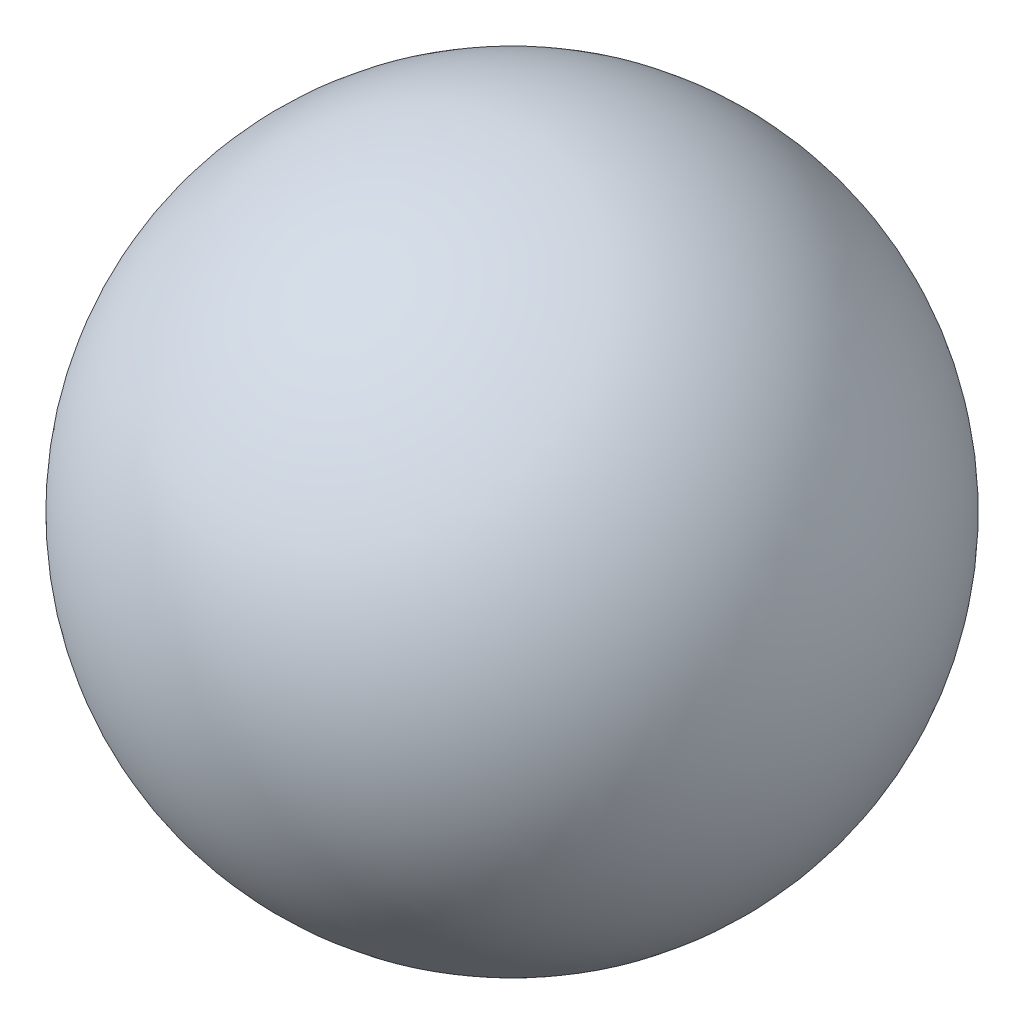
from build123d import *


with BuildPart() as part:
    # 草图1 → 旋转3 (revolve)
    with BuildSketch(Plane.XY):
        with BuildLine():
            Line((0, 21.5), (0, -21.5))
            ThreePointArc((0, -21.5), (-21.5, 0), (0, 21.5))
        make_face()
    revolve(axis=Axis((0, 21.5, 0), (0, -1, 0)))


solid = part.part
